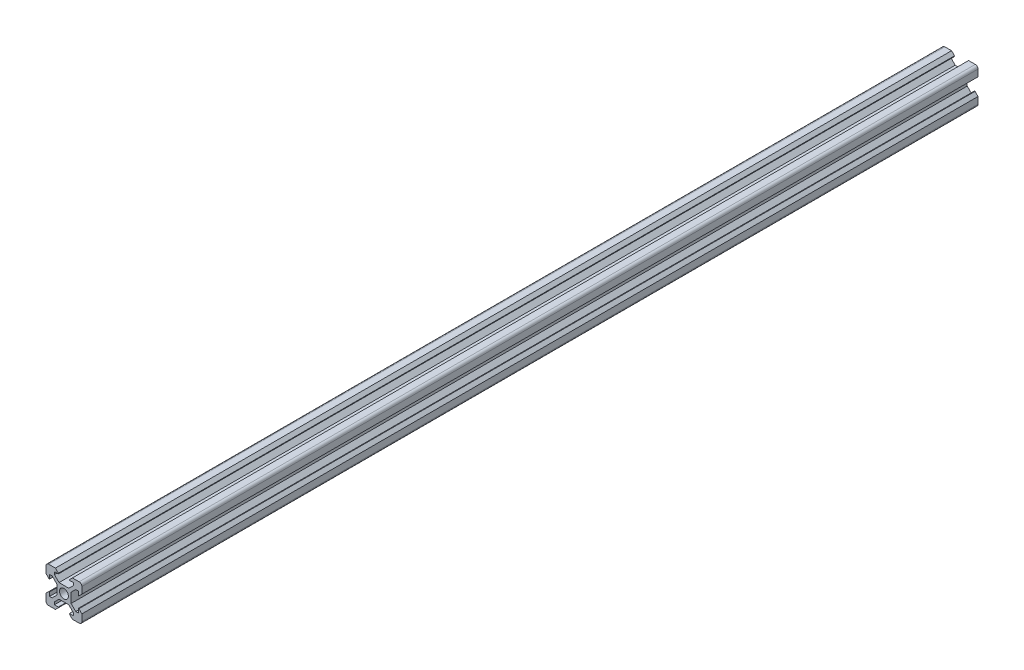
from build123d import *

# Parameters (mm, degrees)
SKETCH2_R           = 2.5
BOSS_EXTRUDE1_DEPTH = 500


with BuildPart() as part:
    # Sketch2 → Boss-Extrude1 (new body)
    with BuildSketch(Plane.XY):
        with BuildLine():
            Line((-4, -2.727207794), (-4, 2.727207794))
            Line((-4, 2.727207794), (-6.572792206, 5.3))
            Line((-6.572792206, 5.3), (-8, 5.3))
            Line((-8, 5.3), (-8, 3.1))
            Line((-8, 3.1), (-8.35, 3.1))
            Line((-8.35, 3.1), (-10, 4.75))
            Line((-10, 4.75), (-10, 8.5))
            ThreePointArc((-10, 8.5), (-9.560660172, 9.560660172), (-8.5, 10))
            Line((-8.5, 10), (-4.75, 10))
            Line((-4.75, 10), (-3.1, 8.35))
            Line((-3.1, 8.35), (-3.1, 8))
            Line((-3.1, 8), (-5.3, 8))
            Line((-5.3, 8), (-5.3, 6.572792206))
            Line((-5.3, 6.572792206), (-2.727207794, 4))
            Line((-2.727207794, 4), (2.727207794, 4))
            Line((2.727207794, 4), (5.3, 6.572792206))
            Line((5.3, 6.572792206), (5.3, 8))
            Line((5.3, 8), (3.1, 8))
            Line((3.1, 8), (3.1, 8.35))
            Line((3.1, 8.35), (4.75, 10))
            Line((4.75, 10), (8.5, 10))
            ThreePointArc((8.5, 10), (9.560660172, 9.560660172), (10, 8.5))
            Line((10, 8.5), (10, 4.75))
            Line((10, 4.75), (8.35, 3.1))
            Line((8.35, 3.1), (8, 3.1))
            Line((8, 3.1), (8, 5.3))
            Line((8, 5.3), (6.572792206, 5.3))
            Line((6.572792206, 5.3), (4, 2.727207794))
            Line((4, 2.727207794), (4, -2.727207794))
            Line((4, -2.727207794), (6.572792206, -5.3))
            Line((6.572792206, -5.3), (8, -5.3))
            Line((8, -5.3), (8, -3.1))
            Line((8, -3.1), (8.35, -3.1))
            Line((8.35, -3.1), (10, -4.75))
            Line((10, -4.75), (10, -8.5))
            ThreePointArc((10, -8.5), (9.560660172, -9.560660172), (8.5, -10))
            Line((8.5, -10), (4.75, -10))
            Line((4.75, -10), (3.1, -8.35))
            Line((3.1, -8.35), (3.1, -8))
            Line((3.1, -8), (5.3, -8))
            Line((5.3, -8), (5.3, -6.572792206))
            Line((5.3, -6.572792206), (2.727207794, -4))
            Line((2.727207794, -4), (-2.727207794, -4))
            Line((-2.727207794, -4), (-5.3, -6.572792206))
            Line((-5.3, -6.572792206), (-5.3, -8))
            Line((-5.3, -8), (-3.1, -8))
            Line((-3.1, -8), (-3.1, -8.35))
            Line((-3.1, -8.35), (-4.75, -10))
            Line((-4.75, -10), (-8.5, -10))
            ThreePointArc((-8.5, -10), (-9.560660172, -9.560660172), (-10, -8.5))
            Line((-10, -8.5), (-10, -4.75))
            Line((-10, -4.75), (-8.35, -3.1))
            Line((-8.35, -3.1), (-8, -3.1))
            Line((-8, -3.1), (-8, -5.3))
            Line((-8, -5.3), (-6.572792206, -5.3))
            Line((-6.572792206, -5.3), (-4, -2.727207794))
        make_face()
        Circle(SKETCH2_R, mode=Mode.SUBTRACT)
    extrude(amount=BOSS_EXTRUDE1_DEPTH)


solid = part.part
